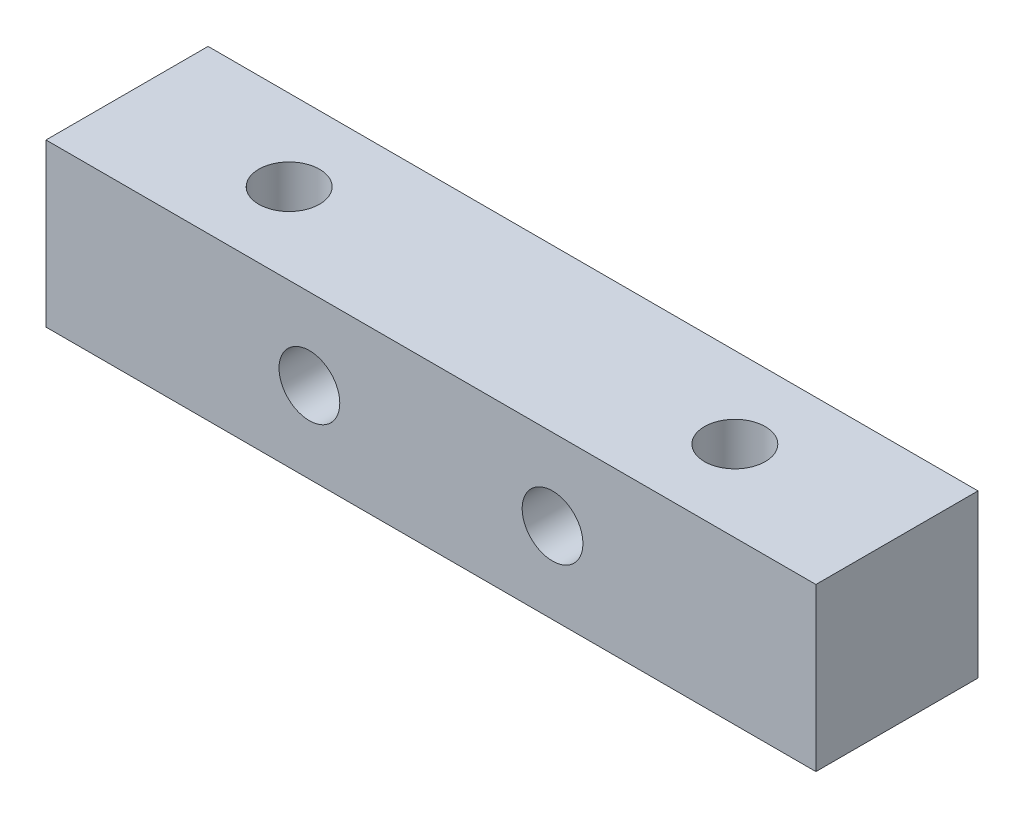
from build123d import *

# Parameters (mm, degrees)
SKETCH_1_W          = 38
SKETCH_1_H          = 8
SKETCH_1_R          = 1.5
EXTRUDE_1_DEPTH     = 8
SKETCH_2_R          = 1.5
CUT_EXTRUDE_1_DEPTH = 8


with BuildPart() as part:
    # 草图1 → 凸台-拉伸1 (new body)
    with BuildSketch(Plane(origin=(0, 0, 0), x_dir=(1, 0, 0), z_dir=(0, 1, 0))):
        Rectangle(SKETCH_1_W, SKETCH_1_H)
        with Locations(Location((-11, 0, 0), (0, 0, 270))):
            Circle(SKETCH_1_R, mode=Mode.SUBTRACT)
        with Locations(Location((11, 0, 0), (0, 0, 270))):
            Circle(SKETCH_1_R, mode=Mode.SUBTRACT)
    extrude(amount=EXTRUDE_1_DEPTH)

    # 草图2 → 切除-拉伸1 (cut)
    with BuildSketch(Plane.XY.offset(4)):
        with Locations((-6, 4)):
            Circle(SKETCH_2_R)
        with Locations(Location((6, 4, 0), (0, 0, 180))):
            Circle(SKETCH_2_R)
    extrude(amount=-CUT_EXTRUDE_1_DEPTH, mode=Mode.SUBTRACT)


solid = part.part
